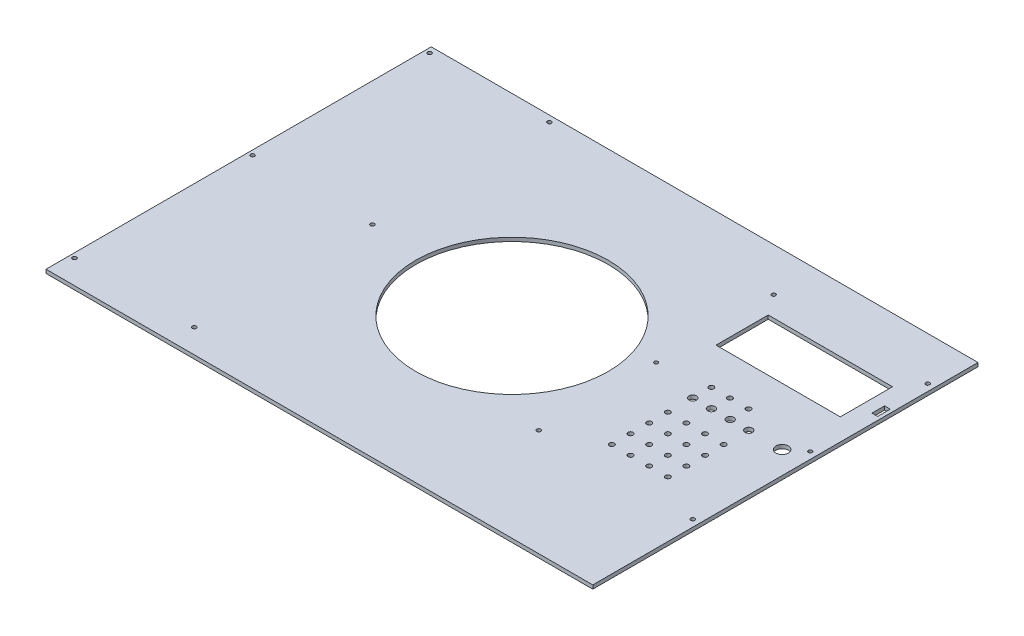
from build123d import *

# Parameters (mm, degrees)
SKETCH1_W           = 440
SKETCH1_H           = 310
SKETCH1_R           = 77.5
SKETCH1_R_2         = 1.6
SKETCH1_R_3         = 2
SKETCH1_R_4         = 3
SKETCH1_R_5         = 5
SKETCH1_R_6         = 1.5
SKETCH1_W_2         = 100
SKETCH1_H_2         = 42
SKETCH1_W_3         = 4.605805555
SKETCH1_H_3         = 10.199999311
BOSS_EXTRUDE1_DEPTH = 1.5


with BuildPart() as part:
    # Sketch1 → Boss-Extrude1 (new, symmetric)
    with BuildSketch(Plane(origin=(0, 0, 0), x_dir=(1, 0, 0), z_dir=(0, 1, 0))):
        Rectangle(SKETCH1_W, SKETCH1_H)
        with Locations(Location((0, 0, 0), (0, 0, 270))):
            Circle(SKETCH1_R, mode=Mode.SUBTRACT)
        with Locations(Location((-216.3, 150, 0), (0, 0, 270))):
            Circle(SKETCH1_R_2, mode=Mode.SUBTRACT)
        with Locations(Location((-119.9, 150, 0), (0, 0, 270))):
            Circle(SKETCH1_R_2, mode=Mode.SUBTRACT)
        with Locations(Location((-216.3, 7.5, 0), (0, 0, 270))):
            Circle(SKETCH1_R_2, mode=Mode.SUBTRACT)
        with Locations(Location((-119.9, 7.5, 0), (0, 0, 270))):
            Circle(SKETCH1_R_2, mode=Mode.SUBTRACT)
        with Locations(Location((-216.3, -135.76, 0), (0, 0, 270))):
            Circle(SKETCH1_R_2, mode=Mode.SUBTRACT)
        with Locations(Location((-119.9, -135.76, 0), (0, 0, 270))):
            Circle(SKETCH1_R_2, mode=Mode.SUBTRACT)
        with Locations(Location((214.5, 120, 0), (0, 0, 270))):
            Circle(SKETCH1_R_2, mode=Mode.SUBTRACT)
        with Locations(Location((90.5, 120, 0), (0, 0, 90))):
            Circle(SKETCH1_R_2, mode=Mode.SUBTRACT)
        with Locations(Location((214.5, -69, 0), (0, 0, 90))):
            Circle(SKETCH1_R_2, mode=Mode.SUBTRACT)
        with Locations(Location((90.5, -69, 0), (0, 0, 270))):
            Circle(SKETCH1_R_2, mode=Mode.SUBTRACT)
        with Locations(Location((130.003003206, 30.382091313, 0), (0, 0, 270))):
            Circle(SKETCH1_R_3, mode=Mode.SUBTRACT)
        with Locations(Location((145.003003686, 30.382093295, 0), (0, 0, 270))):
            Circle(SKETCH1_R_3, mode=Mode.SUBTRACT)
        with Locations(Location((160.003004166, 30.382095278, 0), (0, 0, 270))):
            Circle(SKETCH1_R_3, mode=Mode.SUBTRACT)
        with Locations(Location((129.999987649, 15.524988692, 0), (0, 0, 270))):
            Circle(SKETCH1_R_4, mode=Mode.SUBTRACT)
        with Locations(Location((144.999987649, 15.524988692, 0), (0, 0, 270))):
            Circle(SKETCH1_R_4, mode=Mode.SUBTRACT)
        with Locations(Location((159.999987649, 15.524988692, 0), (0, 0, 270))):
            Circle(SKETCH1_R_4, mode=Mode.SUBTRACT)
        with Locations(Location((174.999987649, 15.524988692, 0), (0, 0, 270))):
            Circle(SKETCH1_R_4, mode=Mode.SUBTRACT)
        with Locations(Location((201.839988749, 15.524998187, 0), (0, 0, 270))):
            Circle(SKETCH1_R_5, mode=Mode.SUBTRACT)
        with Locations(Location((214.499987508, 25.52500018, 0), (0, 0, 270))):
            Circle(SKETCH1_R_6, mode=Mode.SUBTRACT)
        with Locations(Location((90.5, 25.5, 0), (0, 0, 270))):
            Circle(SKETCH1_R_6, mode=Mode.SUBTRACT)
        with Locations(Location((129.857092433, -4.478026946, 0), (0, 0, 270))):
            Circle(SKETCH1_R_3, mode=Mode.SUBTRACT)
        with Locations(Location((144.857092433, -4.478026946, 0), (0, 0, 270))):
            Circle(SKETCH1_R_3, mode=Mode.SUBTRACT)
        with Locations(Location((159.857092433, -4.478026946, 0), (0, 0, 270))):
            Circle(SKETCH1_R_3, mode=Mode.SUBTRACT)
        with Locations(Location((174.857092433, -4.478026946, 0), (0, 0, 270))):
            Circle(SKETCH1_R_3, mode=Mode.SUBTRACT)
        with Locations(Location((144.857092433, -19.478026946, 0), (0, 0, 270))):
            Circle(SKETCH1_R_3, mode=Mode.SUBTRACT)
        with Locations(Location((159.857092433, -19.478026946, 0), (0, 0, 270))):
            Circle(SKETCH1_R_3, mode=Mode.SUBTRACT)
        with Locations(Location((174.857092433, -19.478026946, 0), (0, 0, 270))):
            Circle(SKETCH1_R_3, mode=Mode.SUBTRACT)
        with Locations(Location((144.857092433, -34.478026946, 0), (0, 0, 270))):
            Circle(SKETCH1_R_3, mode=Mode.SUBTRACT)
        with Locations(Location((159.857092433, -34.478026946, 0), (0, 0, 270))):
            Circle(SKETCH1_R_3, mode=Mode.SUBTRACT)
        with Locations(Location((174.857092433, -34.478026946, 0), (0, 0, 270))):
            Circle(SKETCH1_R_3, mode=Mode.SUBTRACT)
        with Locations(Location((144.857092433, -49.478026946, 0), (0, 0, 270))):
            Circle(SKETCH1_R_3, mode=Mode.SUBTRACT)
        with Locations(Location((159.857092433, -49.478026946, 0), (0, 0, 270))):
            Circle(SKETCH1_R_3, mode=Mode.SUBTRACT)
        with Locations(Location((174.857092433, -49.478026946, 0), (0, 0, 270))):
            Circle(SKETCH1_R_3, mode=Mode.SUBTRACT)
        with Locations(Location((129.857092433, -19.478026946, 0), (0, 0, 270))):
            Circle(SKETCH1_R_3, mode=Mode.SUBTRACT)
        with Locations(Location((129.857092433, -34.478026946, 0), (0, 0, 270))):
            Circle(SKETCH1_R_3, mode=Mode.SUBTRACT)
        with Locations(Location((129.857092433, -49.478026946, 0), (0, 0, 270))):
            Circle(SKETCH1_R_3, mode=Mode.SUBTRACT)
        with Locations((152.5, 82.7)):
            Rectangle(SKETCH1_W_2, SKETCH1_H_2, mode=Mode.SUBTRACT)
        with Locations((214.933136209, 82.091000898)):
            Rectangle(SKETCH1_W_3, SKETCH1_H_3, mode=Mode.SUBTRACT)
    extrude(amount=BOSS_EXTRUDE1_DEPTH, both=True)


solid = part.part
